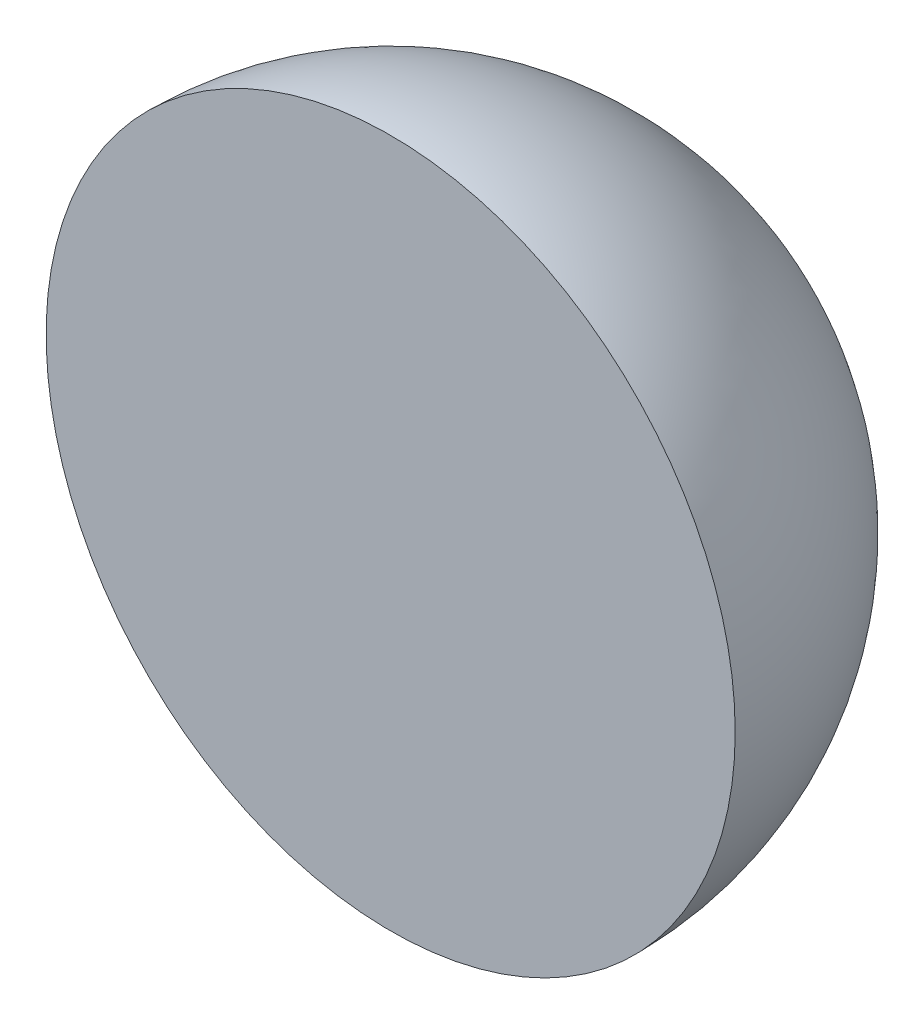
from build123d import *

# Parameters (mm, degrees)
REVOLVE1_ANGLE = 180


with BuildPart() as part:
    # Sketch1 → Revolve1 (revolve)
    with BuildSketch(Plane.XY):
        with BuildLine():
            Line((0.5, 0), (-0.5, 0))
            ThreePointArc((-0.5, 0), (0, 0.5), (0.5, 0))
        make_face()
    revolve(axis=Axis((0.5, 0, 0), (-1, 0, 0)), revolution_arc=REVOLVE1_ANGLE)


solid = part.part
